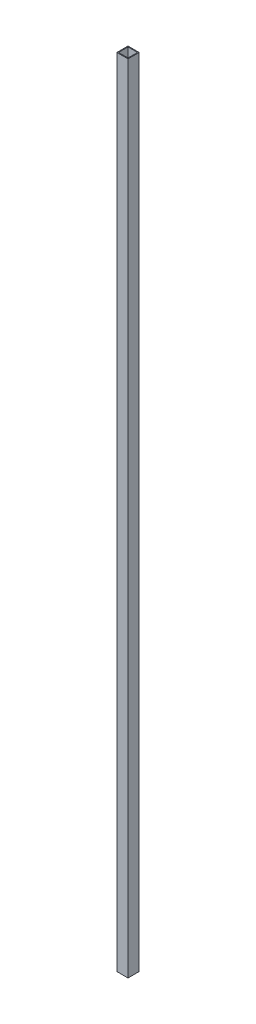
from build123d import *

# Parameters (mm, degrees)
SKETCH1_W           = 14
SKETCH1_H           = 14
SKETCH1_W_2         = 12
SKETCH1_H_2         = 12
BOSS_EXTRUDE1_DEPTH = 1000


with BuildPart() as part:
    # Sketch1 → Boss-Extrude1 (new body)
    with BuildSketch(Plane(origin=(0, 0, 0), x_dir=(1, 0, 0), z_dir=(0, 1, 0))):
        with Locations((-7, -7)):
            Rectangle(SKETCH1_W, SKETCH1_H)
        with Locations((-7, -7)):
            Rectangle(SKETCH1_W_2, SKETCH1_H_2, mode=Mode.SUBTRACT)
    extrude(amount=BOSS_EXTRUDE1_DEPTH)


solid = part.part
